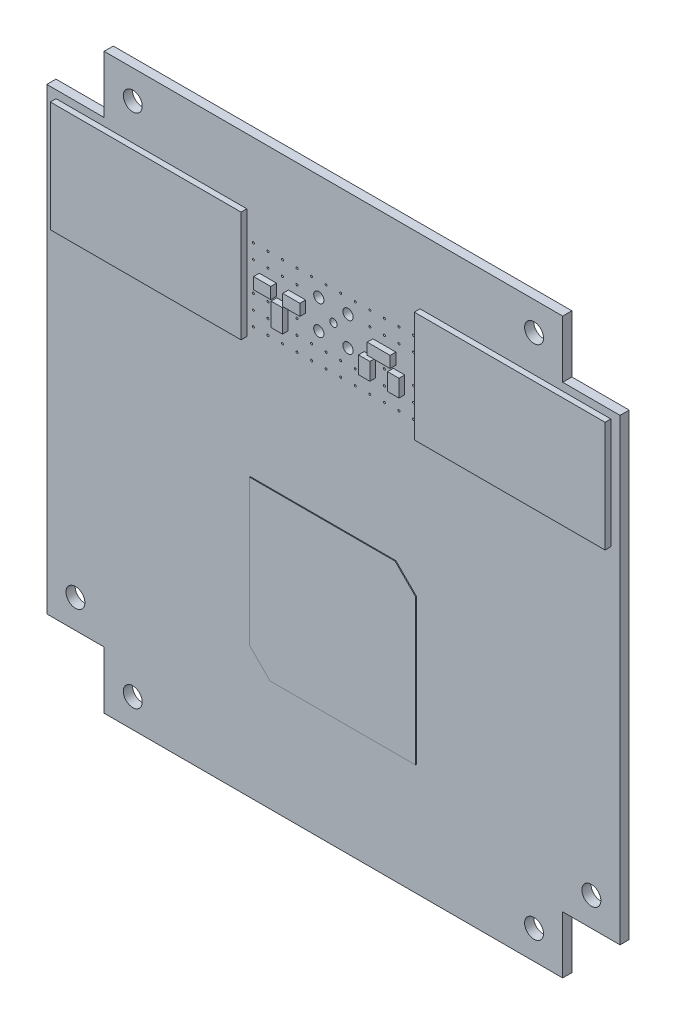
from build123d import *

# Parameters (mm, degrees)
BOARD_DEPTH            = 1.6
SKETCH2_R              = 1.65
SKETCH2_R_2            = 1.7145
SKETCH2_R_3            = 0.175
NON_PLATED_HOLES_DEPTH = 94.507005085
SKETCH3_R              = 0.76
SKETCH3_R_2            = 0.635
SKETCH3_R_3            = 0.89
PLATED_HOLES_DEPTH     = 94.507005085
SKETCH4_W              = 1.9914
SKETCH4_H              = 2.9968
EXTRUDE_C1608_1_DEPTH  = 1
SKETCH5_W              = 1.9914
SKETCH5_H              = 2.9968
EXTRUDE_C1608_2_DEPTH  = 1
SKETCH6_W              = 2.9968
SKETCH6_H              = 1.9914
EXTRUDE_C1608_3_DEPTH  = 1
SKETCH7_W              = 2.9968
SKETCH7_H              = 1.9914
EXTRUDE_C1608_4_DEPTH  = 1
SKETCH8_W              = 3.9968
SKETCH8_H              = 1.9914
L2012C_1_DEPTH         = 1
SKETCH9_W              = 1.9914
SKETCH9_H              = 3.9968
L2012C_2_DEPTH         = 1
SKETCH10_W             = 33.274
SKETCH10_H             = 19.304
CMMOUNTPAD2_1_DEPTH    = 1
SKETCH11_W             = 33.274
SKETCH11_H             = 19.304
CMMOUNTPAD2_2_DEPTH    = 1
SKETCH12_W             = 14.0335
SKETCH12_H             = 14.0335
PANELSMA_1_DEPTH       = 1
SKETCH13_W             = 6.603
SKETCH13_H             = 6.6031
BU_SMA_V_1_DEPTH       = 1
BOSS_EXTRUDE12_DEPTH   = 0.15


with BuildPart() as part:
    # Sketch1 → BOARD (new body)
    with BuildSketch(Plane.XY):
        Polygon((-40, 21), (40, 21), (40, 11), (50, 11), (50, -69), (40, -69), (40, -79), (-40, -79), (-40, -69), (-50, -69), (-50, 11), (-40, 11), align=None)
    extrude(amount=BOARD_DEPTH)

    # Sketch2 → NON-PLATED HOLES (cut, through all)
    with BuildSketch(Plane.XY):
        with Locations((-35, -74)):
            Circle(SKETCH2_R)
        with Locations((35, -74)):
            Circle(SKETCH2_R)
        with Locations((-35, 16)):
            Circle(SKETCH2_R)
        with Locations((35, 16)):
            Circle(SKETCH2_R)
        with Locations((-45, -64)):
            Circle(SKETCH2_R)
        with Locations((45, -64)):
            Circle(SKETCH2_R)
        with Locations((24.13, 0)):
            Circle(SKETCH2_R_2)
        with Locations((39.37, 0)):
            Circle(SKETCH2_R_2)
        with Locations((-39.37, 0)):
            Circle(SKETCH2_R_2)
        with Locations((-24.13, 0)):
            Circle(SKETCH2_R_2)
        with Locations((-11.43, -2.54)):
            Circle(SKETCH2_R_3)
        with Locations((-13.97, -2.54)):
            Circle(SKETCH2_R_3)
        with Locations((-13.97, 2.54)):
            Circle(SKETCH2_R_3)
        with Locations((-11.43, 2.54)):
            Circle(SKETCH2_R_3)
        with Locations((-8.89, 2.54)):
            Circle(SKETCH2_R_3)
        with Locations((-6.35, 2.54)):
            Circle(SKETCH2_R_3)
        with Locations((13.97, 2.54)):
            Circle(SKETCH2_R_3)
        with Locations((11.43, 2.54)):
            Circle(SKETCH2_R_3)
        with Locations((8.89, 2.54)):
            Circle(SKETCH2_R_3)
        with Locations((6.35, 2.54)):
            Circle(SKETCH2_R_3)
        with Locations((-6.35, 5.08)):
            Circle(SKETCH2_R_3)
        with Locations((-3.81, 5.08)):
            Circle(SKETCH2_R_3)
        with Locations((-1.27, 5.08)):
            Circle(SKETCH2_R_3)
        with Locations((1.27, 5.08)):
            Circle(SKETCH2_R_3)
        with Locations((3.81, 5.08)):
            Circle(SKETCH2_R_3)
        with Locations((6.35, 5.08)):
            Circle(SKETCH2_R_3)
        with Locations((-6.35, -2.54)):
            Circle(SKETCH2_R_3)
        with Locations((-6.35, -5.08)):
            Circle(SKETCH2_R_3)
        with Locations((-3.81, -5.08)):
            Circle(SKETCH2_R_3)
        with Locations((-1.27, -5.08)):
            Circle(SKETCH2_R_3)
        with Locations((1.27, -5.08)):
            Circle(SKETCH2_R_3)
        with Locations((3.81, -5.08)):
            Circle(SKETCH2_R_3)
        with Locations((3.81, -7.62)):
            Circle(SKETCH2_R_3)
        with Locations((-6.35, -7.62)):
            Circle(SKETCH2_R_3)
        with Locations((-8.89, -7.62)):
            Circle(SKETCH2_R_3)
        with Locations((-11.43, -7.62)):
            Circle(SKETCH2_R_3)
        with Locations((-11.43, -5.08)):
            Circle(SKETCH2_R_3)
        with Locations((6.35, -7.62)):
            Circle(SKETCH2_R_3)
        with Locations((8.89, -7.62)):
            Circle(SKETCH2_R_3)
        with Locations((8.89, -5.08)):
            Circle(SKETCH2_R_3)
        with Locations((8.89, -2.54)):
            Circle(SKETCH2_R_3)
        with Locations((11.43, -7.62)):
            Circle(SKETCH2_R_3)
        with Locations((13.97, -7.62)):
            Circle(SKETCH2_R_3)
        with Locations((13.97, -5.08)):
            Circle(SKETCH2_R_3)
        with Locations((13.97, -2.54)):
            Circle(SKETCH2_R_3)
        with Locations((-3.81, -7.62)):
            Circle(SKETCH2_R_3)
        with Locations((-1.27, -7.62)):
            Circle(SKETCH2_R_3)
        with Locations((1.27, -7.62)):
            Circle(SKETCH2_R_3)
        with Locations((-13.97, -5.08)):
            Circle(SKETCH2_R_3)
        with Locations((-13.97, -7.62)):
            Circle(SKETCH2_R_3)
        with Locations((-8.89, 5.08)):
            Circle(SKETCH2_R_3)
        with Locations((-11.43, 5.08)):
            Circle(SKETCH2_R_3)
        with Locations((-13.97, 5.08)):
            Circle(SKETCH2_R_3)
        with Locations((8.89, 5.08)):
            Circle(SKETCH2_R_3)
        with Locations((11.43, 5.08)):
            Circle(SKETCH2_R_3)
        with Locations((13.97, 5.08)):
            Circle(SKETCH2_R_3)
    extrude(amount=NON_PLATED_HOLES_DEPTH, mode=Mode.SUBTRACT)

    # Sketch3 → PLATED HOLES (cut, through all)
    with BuildSketch(Plane.XY):
        with Locations((0, -49.85)):
            Circle(SKETCH3_R)
        Circle(SKETCH3_R_2)
        with Locations((2.55, 2.55)):
            Circle(SKETCH3_R_3)
        with Locations((-2.55, 2.55)):
            Circle(SKETCH3_R_3)
        with Locations((-2.55, -2.55)):
            Circle(SKETCH3_R_3)
        with Locations((2.55, -2.55)):
            Circle(SKETCH3_R_3)
    extrude(amount=PLATED_HOLES_DEPTH, mode=Mode.SUBTRACT)

    # Sketch14 → Boss-Extrude12 (add)
    with BuildSketch(Plane.XY.offset(1.6)):
        Polygon((0, -30.5), (10.9, -30.5), (14.5, -34.1), (14.5, -49.85), (14.5, -59.5), (0, -59.5), (-10.9, -59.5), (-14.5, -55.9), (-14.5, -49.85), (-14.5, -30.5), align=None)
    extrude(amount=BOSS_EXTRUDE12_DEPTH)


with BuildPart() as body_2:
    # Sketch4 → Extrude C1608-1 (new body)
    with BuildSketch(Plane.XY.offset(1.6)):
        with Locations((6.3627, -3.175)):
            Rectangle(SKETCH4_W, SKETCH4_H)
    extrude(amount=EXTRUDE_C1608_1_DEPTH)


with BuildPart() as body_3:
    # Sketch5 → Extrude C1608-2 (new body)
    with BuildSketch(Plane.XY.offset(1.6)):
        with Locations((11.4427, -3.175)):
            Rectangle(SKETCH5_W, SKETCH5_H)
    extrude(amount=EXTRUDE_C1608_2_DEPTH)


with BuildPart() as body_4:
    # Sketch6 → Extrude C1608-3 (new body)
    with BuildSketch(Plane.XY.offset(1.6)):
        with Locations((-6.35, 0.0127)):
            Rectangle(SKETCH6_W, SKETCH6_H)
    extrude(amount=EXTRUDE_C1608_3_DEPTH)


with BuildPart() as body_5:
    # Sketch7 → Extrude C1608-4 (new body)
    with BuildSketch(Plane.XY.offset(1.6)):
        with Locations((-11.43, 0.0127)):
            Rectangle(SKETCH7_W, SKETCH7_H)
    extrude(amount=EXTRUDE_C1608_4_DEPTH)


with BuildPart() as body_6:
    # Sketch8 → L2012C-1 (new body)
    with BuildSketch(Plane.XY.offset(1.6)):
        with Locations((8.89, 0.0127)):
            Rectangle(SKETCH8_W, SKETCH8_H)
    extrude(amount=L2012C_1_DEPTH)


with BuildPart() as body_7:
    # Sketch9 → L2012C-2 (new body)
    with BuildSketch(Plane.XY.offset(1.6)):
        with Locations((-8.8773, -3.175)):
            Rectangle(SKETCH9_W, SKETCH9_H)
    extrude(amount=L2012C_2_DEPTH)


with BuildPart() as body_8:
    # Sketch10 → CMMOUNTPAD2-1 (new body)
    with BuildSketch(Plane.XY.offset(1.6)):
        with Locations((31.75, 0)):
            Rectangle(SKETCH10_W, SKETCH10_H)
    extrude(amount=CMMOUNTPAD2_1_DEPTH)


with BuildPart() as body_9:
    # Sketch11 → CMMOUNTPAD2-2 (new body)
    with BuildSketch(Plane.XY.offset(1.6)):
        with Locations((-31.75, 0)):
            Rectangle(SKETCH11_W, SKETCH11_H)
    extrude(amount=CMMOUNTPAD2_2_DEPTH)


with BuildPart() as body_10:
    # Sketch12 → PANELSMA-1 (new body)
    with BuildSketch(Plane.XY):
        with Locations((-0.03175, -49.81825)):
            Rectangle(SKETCH12_W, SKETCH12_H)
    extrude(amount=-PANELSMA_1_DEPTH)


with BuildPart() as body_11:
    # Sketch13 → BU-SMA-V-1 (new body)
    with BuildSketch(Plane.XY):
        with Locations((0, 5e-05)):
            Rectangle(SKETCH13_W, SKETCH13_H)
    extrude(amount=-BU_SMA_V_1_DEPTH)


solid = Compound([part.part, body_2.part, body_3.part, body_4.part, body_5.part, body_6.part, body_7.part, body_8.part, body_9.part, body_10.part, body_11.part])
